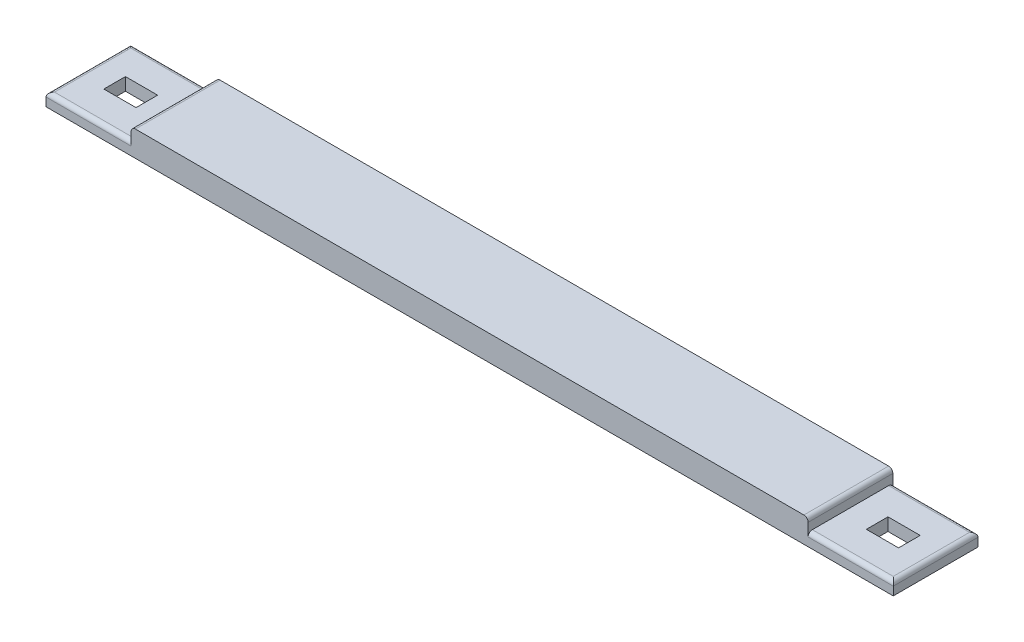
from build123d import *

# Parameters (mm, degrees)
SKETCH1_W           = 200
SKETCH1_H           = 20
SKETCH1_W_2         = 7.6
SKETCH1_H_2         = 5.1
BOSS_EXTRUDE1_DEPTH = 6
SKETCH2_W           = 20.1
SKETCH2_H           = 20
CUT_EXTRUDE1_DEPTH  = 3
FILLET1_R           = 1


with BuildPart() as part:
    # Sketch1 → Boss-Extrude1 (new body)
    with BuildSketch(Plane(origin=(0, 0, 0), x_dir=(1, 0, 0), z_dir=(0, 1, 0))):
        Rectangle(SKETCH1_W, SKETCH1_H)
        with Locations((-90, 0)):
            Rectangle(SKETCH1_W_2, SKETCH1_H_2, mode=Mode.SUBTRACT)
        with Locations((90, 0)):
            Rectangle(SKETCH1_W_2, SKETCH1_H_2, mode=Mode.SUBTRACT)
    extrude(amount=BOSS_EXTRUDE1_DEPTH)

    # Sketch2 → Cut-Extrude1 (cut)
    with BuildSketch(Plane(origin=(0, 6, 0), x_dir=(1, 0, 0), z_dir=(0, 1, 0))):
        with Locations((-89.95, 0)):
            Rectangle(SKETCH2_W, SKETCH2_H)
        with Locations((89.95, 0)):
            Rectangle(SKETCH2_W, SKETCH2_H)
    extrude(amount=-CUT_EXTRUDE1_DEPTH, mode=Mode.SUBTRACT)

    # Fillet1
    fillet1_edges = [part.edges().sort_by_distance(p)[0] for p in [
        (-100, 3, 0),
        (-89.95, 3, -10),
        (-89.95, 3, 10),
        (-79.9, 6, 0),
        (100, 3, 0),
        (89.95, 3, 10),
        (89.95, 3, -10),
        (79.9, 6, 0),
    ]]
    fillet(fillet1_edges, radius=FILLET1_R)


solid = part.part
